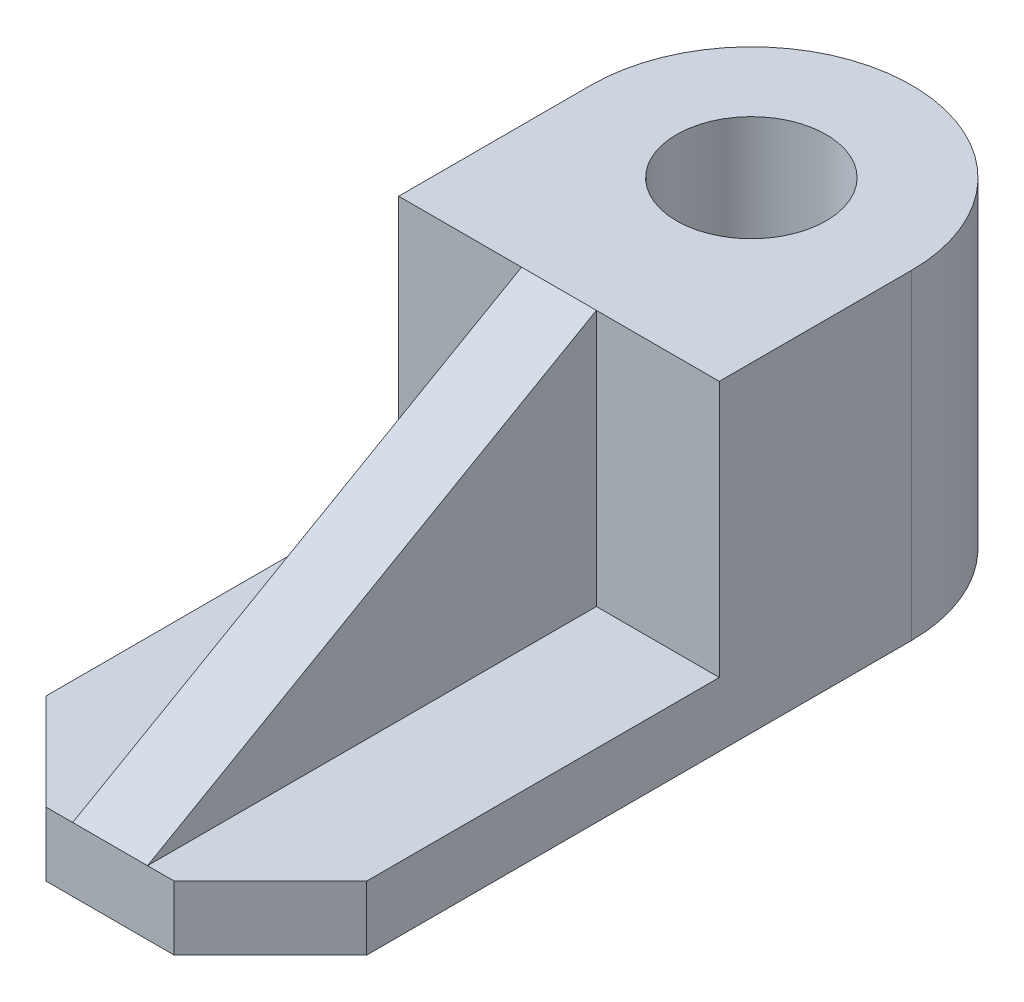
from build123d import *

# Parameters (mm, degrees)
SKETCH1_R           = 7
BOSS_EXTRUDE2_DEPTH = 30
BOSS_EXTRUDE4_DEPTH = 6
RIB3_REACH          = 55.749
SKETCH5_WALL_W      = 157.872383692
SKETCH5_WALL_H      = 7


with BuildPart() as part:
    # Sketch1 → Boss-Extrude2 (new body)
    with BuildSketch(Plane(origin=(0, 0, 0), x_dir=(1, 0, 0), z_dir=(0, 1, 0))):
        with BuildLine():
            Line((0, 0), (30, 0))
            Line((30, 0), (30, 18))
            ThreePointArc((30, 18), (15, 33), (0, 18))
            Line((0, 18), (0, 0))
        make_face()
        with Locations(Location((15, 18, 0), (0, 0, 270))):
            Circle(SKETCH1_R, mode=Mode.SUBTRACT)
    extrude(amount=BOSS_EXTRUDE2_DEPTH)

    # Sketch3 → Boss-Extrude4 (add)
    with BuildSketch(Plane(origin=(0, 0, 0), x_dir=(-1, 0, 0), z_dir=(0, -1, 0))):
        Polygon((-21, -42), (-30, -33), (-30, 0), (0, 0), (0, -33), (-9, -42), align=None)
    extrude(amount=-BOSS_EXTRUDE4_DEPTH)

    # Sketch5 wall → Rib3 (add, up to next)
    with BuildSketch(Plane(origin=(15, 18, 21), x_dir=(0, -0.496138938357, 0.868243142124), z_dir=(0, 0.868243142124, 0.496138938357)), mode=Mode.PRIVATE) as rib3_sk1:
        Rectangle(SKETCH5_WALL_W, SKETCH5_WALL_H)
    rib3_tool1 = extrude(rib3_sk1.sketch, amount=-RIB3_REACH, mode=Mode.PRIVATE) - part.part
    add(rib3_tool1.solids().sort_by_distance((15, 18, 21))[0])


solid = part.part
